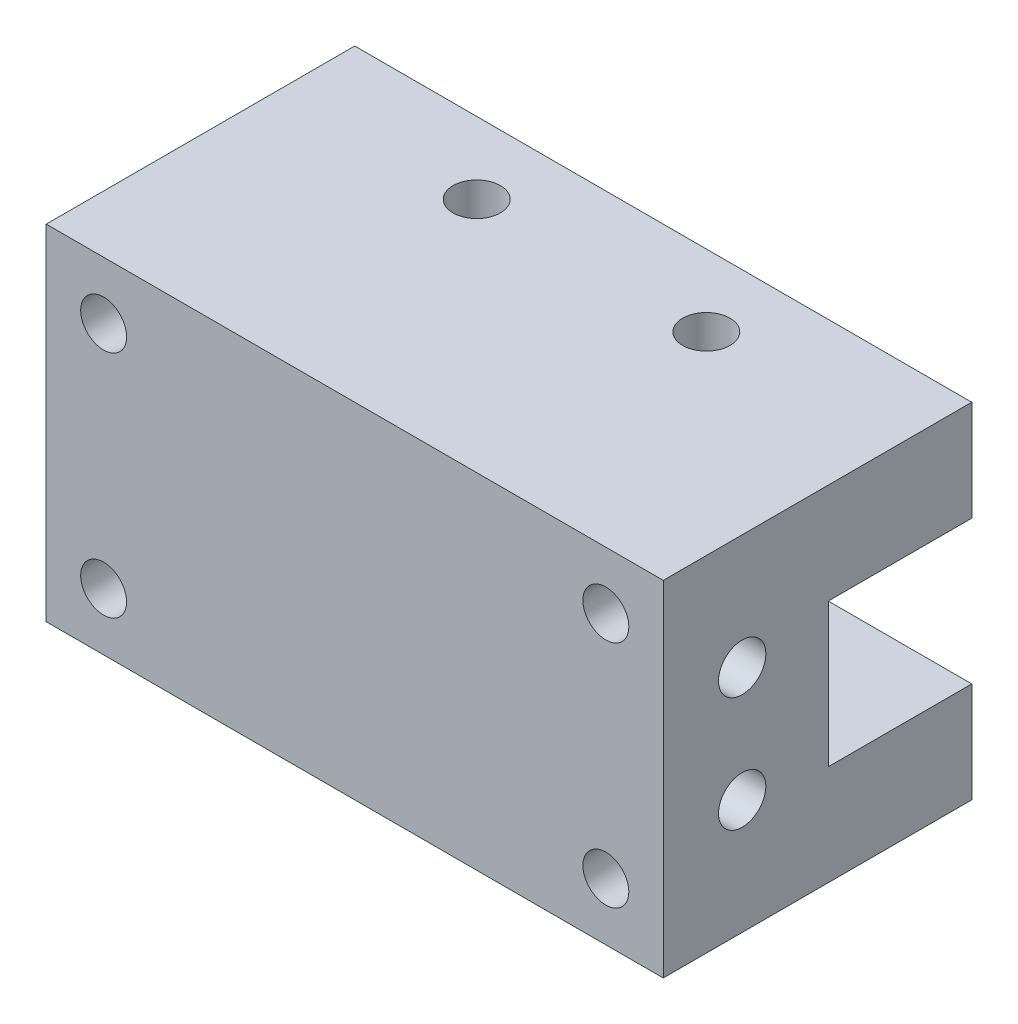
from build123d import *

# Parameters (mm, degrees)
SKETCH_1_W             = 43
SKETCH_1_H             = 24
SKETCH_1_R             = 1.6
EXTRUDE_1_DEPTH        = 11.5
SKETCH_3_W             = 43
SKETCH_3_H             = 7
SKETCH_3_R             = 2.75
EXTRUDE_2_DEPTH        = 10
CUT_EXTRUDE_START      = -15
SKETCH_4_R             = 2.1
CUT_EXTRUDE_1_DEPTH    = 10
HOLE_WIZARD_M4_1_D     = 3.3
HOLE_WIZARD_M4_1_DEPTH = 10.1
HOLE_WIZARD_M4_1_TIP   = 0.991420021
HOLE_WIZARD_M4_2_D     = 3.3
HOLE_WIZARD_M4_2_DEPTH = 10.1
HOLE_WIZARD_M4_2_TIP   = 0.991420021


with BuildPart() as part:
    # 草图1 → 凸台-拉伸1 (new body)
    with BuildSketch(Plane.XY):
        Rectangle(SKETCH_1_W, SKETCH_1_H)
        with Locations((-17.5, 8)):
            Circle(SKETCH_1_R, mode=Mode.SUBTRACT)
        with Locations((-17.5, -8)):
            Circle(SKETCH_1_R, mode=Mode.SUBTRACT)
        with Locations((17.5, -8)):
            Circle(SKETCH_1_R, mode=Mode.SUBTRACT)
        with Locations((17.5, 8)):
            Circle(SKETCH_1_R, mode=Mode.SUBTRACT)
    extrude(amount=EXTRUDE_1_DEPTH)

    # 草图3 → 凸台-拉伸2 (add)
    # profile 1 of 2: a face of its own
    with BuildSketch(Plane(origin=(0, 0, 0), x_dir=(-1, 0, 0), z_dir=(0, 0, -1))):
        with Locations((0, -8.5)):
            Rectangle(SKETCH_3_W, SKETCH_3_H)
        with Locations((-17.5, -8)):
            Circle(SKETCH_3_R, mode=Mode.SUBTRACT)
        with Locations((17.5, -8)):
            Circle(SKETCH_3_R, mode=Mode.SUBTRACT)
    # profile 2 of 2: a face of its own
    with BuildSketch(Plane(origin=(0, 0, 0), x_dir=(-1, 0, 0), z_dir=(0, 0, -1))):
        with Locations((0, 8.5)):
            Rectangle(SKETCH_3_W, SKETCH_3_H)
        with Locations((17.5, 8)):
            Circle(SKETCH_3_R, mode=Mode.SUBTRACT)
        with Locations((-17.5, 8)):
            Circle(SKETCH_3_R, mode=Mode.SUBTRACT)
    extrude(amount=EXTRUDE_2_DEPTH)

    # 草图4 → 切除-拉伸1 (cut)
    with BuildSketch(Plane(origin=(0, 12, 0), x_dir=(1, 0, 0), z_dir=(0, 1, 0)).offset(CUT_EXTRUDE_START)):
        with Locations(Location((8, 5, 0), (0, 0, 180))):
            Circle(SKETCH_4_R)
        with Locations(Location((-8, 5, 0), (0, 0, 180))):
            Circle(SKETCH_4_R)
    extrude(amount=-CUT_EXTRUDE_1_DEPTH, mode=Mode.SUBTRACT)

    # M4 螺纹孔1
    with Locations(Plane(origin=(0, 12, 0), x_dir=(1, 0, 0), z_dir=(0, 1, 0))):
        with Locations((-8, 5), (8, 5)):
            Hole(HOLE_WIZARD_M4_1_D / 2, depth=HOLE_WIZARD_M4_1_DEPTH)
            with Locations((0, 0, -(HOLE_WIZARD_M4_1_DEPTH + HOLE_WIZARD_M4_1_TIP / 2))):  # 118° drill point
                Cone(0, HOLE_WIZARD_M4_1_D / 2, HOLE_WIZARD_M4_1_TIP, mode=Mode.SUBTRACT)

    # M4 螺纹孔2
    with Locations(Plane(origin=(21.5, 4, 6), x_dir=(0, 1, 0), z_dir=(1, 0, 0))):
        with Locations((0, 0), (-8, 0)):
            Hole(HOLE_WIZARD_M4_2_D / 2, depth=HOLE_WIZARD_M4_2_DEPTH)
            with Locations((0, 0, -(HOLE_WIZARD_M4_2_DEPTH + HOLE_WIZARD_M4_2_TIP / 2))):  # 118° drill point
                Cone(0, HOLE_WIZARD_M4_2_D / 2, HOLE_WIZARD_M4_2_TIP, mode=Mode.SUBTRACT)


solid = part.part
